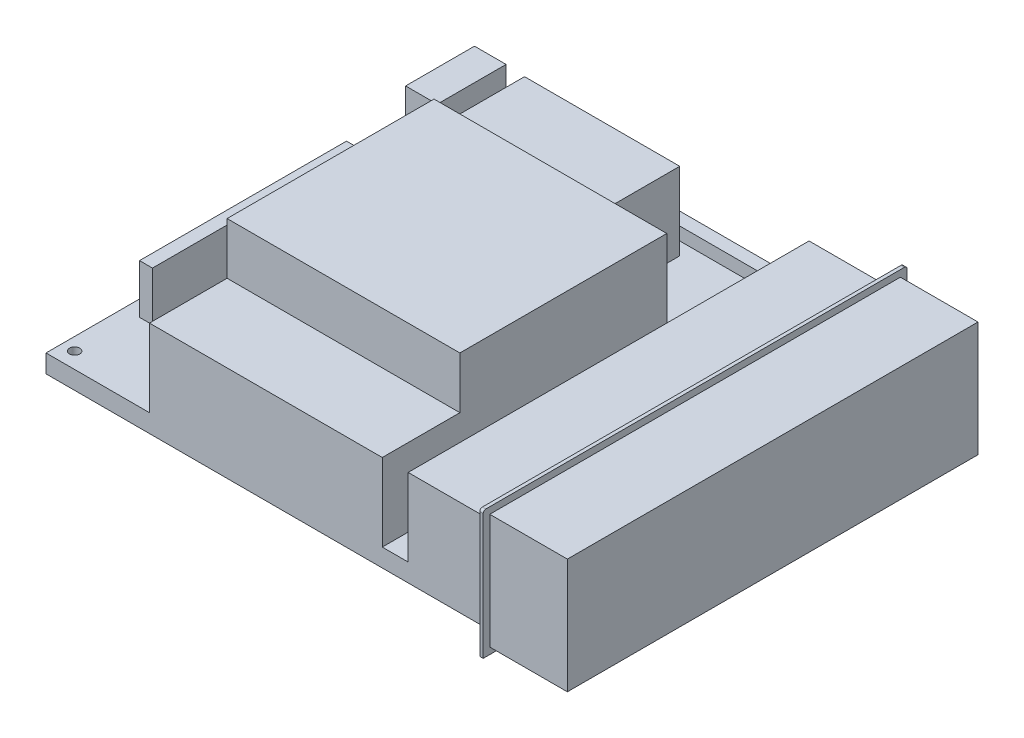
from build123d import *

# Parameters (mm, degrees)
SKETCH1_W                          = 170
SKETCH1_H                          = 170
ALUSPLAAT_DEPTH                    = 2
SKETCH2_W                          = 30
SKETCH2_H                          = 155
PISTIKUD_DEPTH                     = 35
SKETCH3_W                          = 90
SKETCH3_H                          = 110
CPU_M_LUD_DEPTH                    = 55
SKETCH4_W                          = 60
SKETCH4_H                          = 35
SININE_RADIKAS_DEPTH               = 35
SKETCH5_W                          = 90
SKETCH5_H                          = 5
PCIE_PESA_DEPTH                    = 10
SKETCH6_W                          = 12.216790721
SKETCH6_H                          = 26.62710746
RAID_PESAD_DEPTH                   = 30
SKETCH7_W                          = 170
SKETCH7_H                          = 170
LE_LDINE_M_RA_DEPTH                = 5
SKETCH8_W                          = 5
SKETCH8_H                          = 80
PATREI_JA_IGASUGUSED_L_LITID_DEPTH = 19
SKETCH9_OUTSIDE_W                  = 221.416
SKETCH9_OUTSIDE_H                  = 221.416
SKETCH9_OUTSIDE_W_2                = 90
SKETCH9_OUTSIDE_H_2                = 80
M_LUD_DEPTH                        = 20
CUT_EXTRUDE2_REACH                 = 132.192
SKETCH10_R                         = 1.98
BOSS_EXTRUDE1_DEPTH                = 1.32
SKETCH12_W                         = 158.75
SKETCH12_H                         = 44.45
BOSS_EXTRUDE2_DEPTH                = 30


with BuildPart() as part:
    # Sketch1 → alusplaat (new body)
    with BuildSketch(Plane(origin=(0, 0, 0), x_dir=(1, 0, 0), z_dir=(0, 1, 0))):
        Rectangle(SKETCH1_W, SKETCH1_H)
    extrude(amount=ALUSPLAAT_DEPTH)

    # Sketch2 → pistikud (add)
    with BuildSketch(Plane(origin=(0, 2, 0), x_dir=(-1, 0, 0), z_dir=(0, 1, 0))):
        with Locations((-70, 7.5)):
            Rectangle(SKETCH2_W, SKETCH2_H)
    extrude(amount=PISTIKUD_DEPTH)

    # Sketch3 → cpu+mälud (add)
    with BuildSketch(Plane(origin=(0, 2, 0), x_dir=(1, 0, 0), z_dir=(0, 1, 0))):
        with Locations((0, -30)):
            Rectangle(SKETCH3_W, SKETCH3_H)
    extrude(amount=CPU_M_LUD_DEPTH)

    # Sketch4 → sinine radikas (add)
    with BuildSketch(Plane(origin=(0, 2, 0), x_dir=(1, 0, 0), z_dir=(0, 1, 0))):
        with Locations((-25, 52.5)):
            Rectangle(SKETCH4_W, SKETCH4_H)
    extrude(amount=SININE_RADIKAS_DEPTH)

    # Sketch5 → pcie pesa (add)
    with BuildSketch(Plane(origin=(0, 2, 0), x_dir=(-1, 0, 0), z_dir=(0, 1, 0))):
        with Locations((0, -77.5)):
            Rectangle(SKETCH5_W, SKETCH5_H)
    extrude(amount=PCIE_PESA_DEPTH)

    # Sketch6 → raid pesad (add)
    with BuildSketch(Plane(origin=(0, 2, 0), x_dir=(-1, 0, 0), z_dir=(0, 1, 0))):
        with Locations((73.780405742, -62.225935716)):
            Rectangle(SKETCH6_W, SKETCH6_H)
    extrude(amount=RAID_PESAD_DEPTH)

    # Sketch7 → üleüldine müra (add)
    with BuildSketch(Plane(origin=(0, 2, 0), x_dir=(-1, 0, 0), z_dir=(0, 1, 0))):
        Rectangle(SKETCH7_W, SKETCH7_H)
    extrude(amount=LE_LDINE_M_RA_DEPTH)

    # Sketch8 → patrei ja igasugused lülitid (add)
    with BuildSketch(Plane(origin=(0, 7, 0), x_dir=(-1, 0, 0), z_dir=(0, 1, 0))):
        with Locations((76.340130234, 15)):
            Rectangle(SKETCH8_W, SKETCH8_H)
    extrude(amount=PATREI_JA_IGASUGUSED_L_LITID_DEPTH)

    # Sketch9 outside → mälud (cut)
    with BuildSketch(Plane(origin=(0, 57, 0), x_dir=(-1, 0, 0), z_dir=(0, 1, 0))):
        Rectangle(SKETCH9_OUTSIDE_W, SKETCH9_OUTSIDE_H)
        with Locations((0, 15)):
            Rectangle(SKETCH9_OUTSIDE_W_2, SKETCH9_OUTSIDE_H_2, mode=Mode.SUBTRACT)
    extrude(amount=-M_LUD_DEPTH, mode=Mode.SUBTRACT)

    # Sketch10 → Cut-Extrude2 (cut, up to next)
    with BuildSketch(Plane(origin=(0, 7, 0), x_dir=(1, 0, 0), z_dir=(0, 1, 0)), mode=Mode.PRIVATE) as cut_extrude2_sk1:
        with Locations(Location((74.84, 78.65, 0), (0, 0, 270))):
            Circle(SKETCH10_R)
    cut_extrude2_tool1 = extrude(cut_extrude2_sk1.sketch, amount=-CUT_EXTRUDE2_REACH, mode=Mode.PRIVATE) & part.part
    # Sketch10 → Cut-Extrude2 (cut, up to next)
    with BuildSketch(Plane(origin=(0, 7, 0), x_dir=(1, 0, 0), z_dir=(0, 1, 0)), mode=Mode.PRIVATE) as cut_extrude2_sk2:
        with Locations(Location((-80.1, 78.65, 0), (0, 0, 270))):
            Circle(SKETCH10_R)
    cut_extrude2_tool2 = extrude(cut_extrude2_sk2.sketch, amount=-CUT_EXTRUDE2_REACH, mode=Mode.PRIVATE) & part.part
    # Sketch10 → Cut-Extrude2 (cut, up to next)
    with BuildSketch(Plane(origin=(0, 7, 0), x_dir=(1, 0, 0), z_dir=(0, 1, 0)), mode=Mode.PRIVATE) as cut_extrude2_sk3:
        with Locations(Location((-80.1, -78.83, 0), (0, 0, 270))):
            Circle(SKETCH10_R)
    cut_extrude2_tool3 = extrude(cut_extrude2_sk3.sketch, amount=-CUT_EXTRUDE2_REACH, mode=Mode.PRIVATE) & part.part
    # Sketch10 → Cut-Extrude2 (cut, up to next)
    with BuildSketch(Plane(origin=(0, 7, 0), x_dir=(1, 0, 0), z_dir=(0, 1, 0)), mode=Mode.PRIVATE) as cut_extrude2_sk4:
        with Locations(Location((51.98, -78.83, 0), (0, 0, 270))):
            Circle(SKETCH10_R)
    cut_extrude2_tool4 = extrude(cut_extrude2_sk4.sketch, amount=-CUT_EXTRUDE2_REACH, mode=Mode.PRIVATE) & part.part
    add(cut_extrude2_tool1.solids().sort_by_distance((74.84, 7, -78.65))[0], mode=Mode.SUBTRACT)
    add(cut_extrude2_tool2.solids().sort_by_distance((-80.1, 7, -78.65))[0], mode=Mode.SUBTRACT)
    add(cut_extrude2_tool3.solids().sort_by_distance((-80.1, 7, 78.83))[0], mode=Mode.SUBTRACT)
    add(cut_extrude2_tool4.solids().sort_by_distance((51.98, 7, 78.83))[0], mode=Mode.SUBTRACT)


with BuildPart() as body_2:
    # Sketch11 → Boss-Extrude1 (new body)
    with BuildSketch(Plane(origin=(87.11, 0, 0), x_dir=(0, 0, -1), z_dir=(1, 0, 0))):
        with BuildLine():
            Line((-88.415, 43.18), (73.415, 43.18))
            ThreePointArc((73.415, 43.18), (74.122106781, 42.887106781), (74.415, 42.18))
            Line((74.415, 42.18), (74.415, -5.35))
            ThreePointArc((74.415, -5.35), (74.122106781, -6.057106781), (73.415, -6.35))
            Line((73.415, -6.35), (-89.415, -6.35))
            Line((-89.415, -6.35), (-89.415, 42.18))
            ThreePointArc((-89.415, 42.18), (-89.122106781, 42.887106781), (-88.415, 43.18))
        make_face()
    extrude(amount=BOSS_EXTRUDE1_DEPTH)


with BuildPart() as body_3:
    # Sketch12 → Boss-Extrude2 (new body)
    with BuildSketch(Plane(origin=(88.43, 0, 0), x_dir=(0, 0, -1), z_dir=(1, 0, 0))):
        with Locations((-7.5, 18.415)):
            Rectangle(SKETCH12_W, SKETCH12_H)
    extrude(amount=BOSS_EXTRUDE2_DEPTH)


solid = Compound([part.part, body_2.part, body_3.part])
